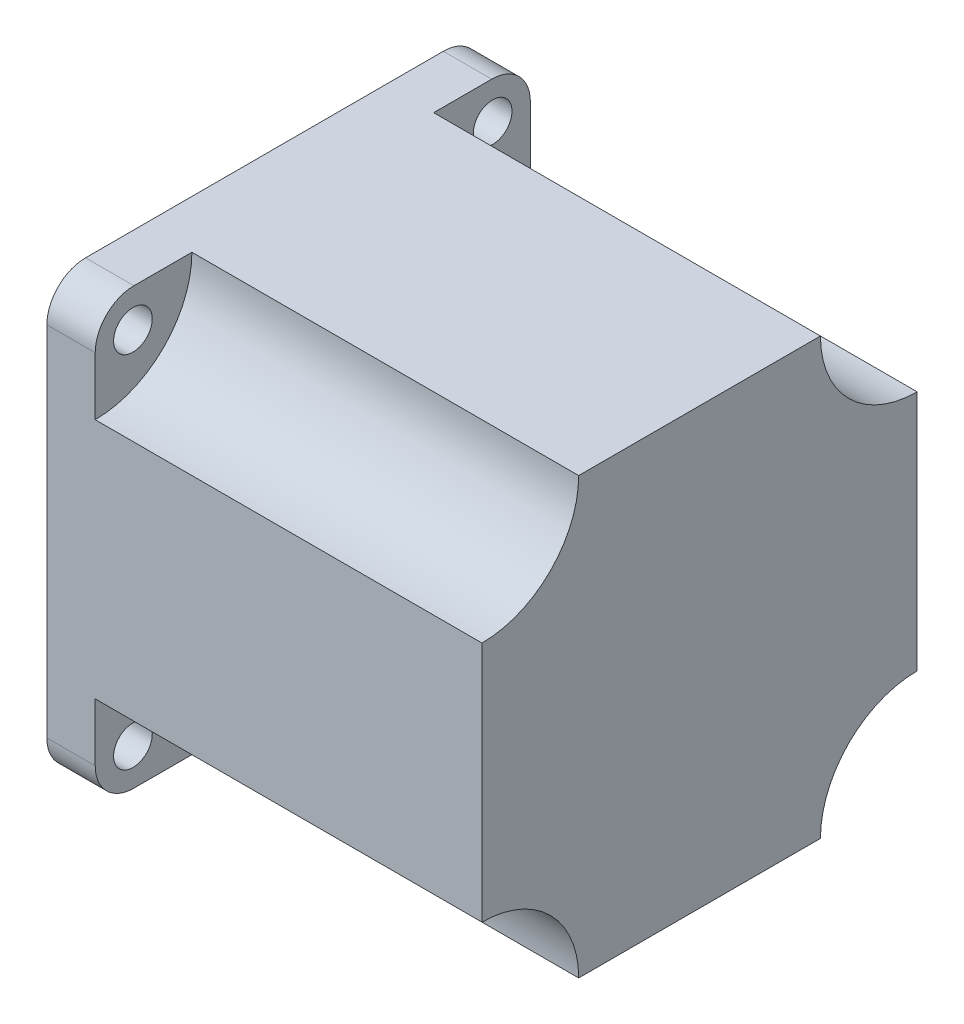
from build123d import *

# Parameters (mm, degrees)
SKETCH1_W           = 57.15
SKETCH1_H           = 57.15
SKETCH1_R           = 2.54
BOSS_EXTRUDE1_DEPTH = 6.35
FILLET1_R           = 5.08
SKETCH5_R           = 19.05
BOSS_EXTRUDE4_DEPTH = 1.524
SKETCH6_R           = 3.175
BOSS_EXTRUDE5_DEPTH = 19.05
BOSS_EXTRUDE6_DEPTH = 50.8


with BuildPart() as part:
    # Sketch1 → Boss-Extrude1 (new body)
    with BuildSketch(Plane(origin=(0, 0, 0), x_dir=(0, 0, -1), z_dir=(1, 0, 0))):
        Rectangle(SKETCH1_W, SKETCH1_H)
        with Locations((23.622, 23.622)):
            Circle(SKETCH1_R, mode=Mode.SUBTRACT)
        with Locations((-23.622, 23.622)):
            Circle(SKETCH1_R, mode=Mode.SUBTRACT)
        with Locations((-23.622, -23.622)):
            Circle(SKETCH1_R, mode=Mode.SUBTRACT)
        with Locations((23.622, -23.622)):
            Circle(SKETCH1_R, mode=Mode.SUBTRACT)
    extrude(amount=BOSS_EXTRUDE1_DEPTH)

    # Fillet1
    fillet1_edges = [part.edges().sort_by_distance(p)[0] for p in [
        (3.175, 28.575, 28.575),
        (3.175, 28.575, -28.575),
        (3.175, -28.575, -28.575),
        (3.175, -28.575, 28.575),
    ]]
    fillet(fillet1_edges, radius=FILLET1_R)

    # Sketch5 → Boss-Extrude4 (add)
    with BuildSketch(Plane.ZY):
        with Locations(Location((0, 0, 0), (0, 0, 180))):
            Circle(SKETCH5_R)
    extrude(amount=BOSS_EXTRUDE4_DEPTH)

    # Sketch6 → Boss-Extrude5 (add)
    with BuildSketch(Plane.ZY.offset(1.524)):
        with Locations(Location((0, 0, 0), (0, 0, 180))):
            Circle(SKETCH6_R)
    extrude(amount=BOSS_EXTRUDE5_DEPTH)

    # Sketch7 → Boss-Extrude6 (add)
    with BuildSketch(Plane(origin=(6.35, 0, 0), x_dir=(0, 0, -1), z_dir=(1, 0, 0))):
        with BuildLine():
            Line((-15.875, 28.575), (15.875, 28.575))
            ThreePointArc((15.875, 28.575), (19.594743879, 19.594743879), (28.575, 15.875))
            Line((28.575, 15.875), (28.575, -15.875))
            ThreePointArc((28.575, -15.875), (19.594743879, -19.594743879), (15.875, -28.575))
            Line((15.875, -28.575), (-15.875, -28.575))
            ThreePointArc((-15.875, -28.575), (-19.594743879, -19.594743879), (-28.575, -15.875))
            Line((-28.575, -15.875), (-28.575, 15.875))
            ThreePointArc((-28.575, 15.875), (-19.594743879, 19.594743879), (-15.875, 28.575))
        make_face()
    extrude(amount=BOSS_EXTRUDE6_DEPTH)


solid = part.part
